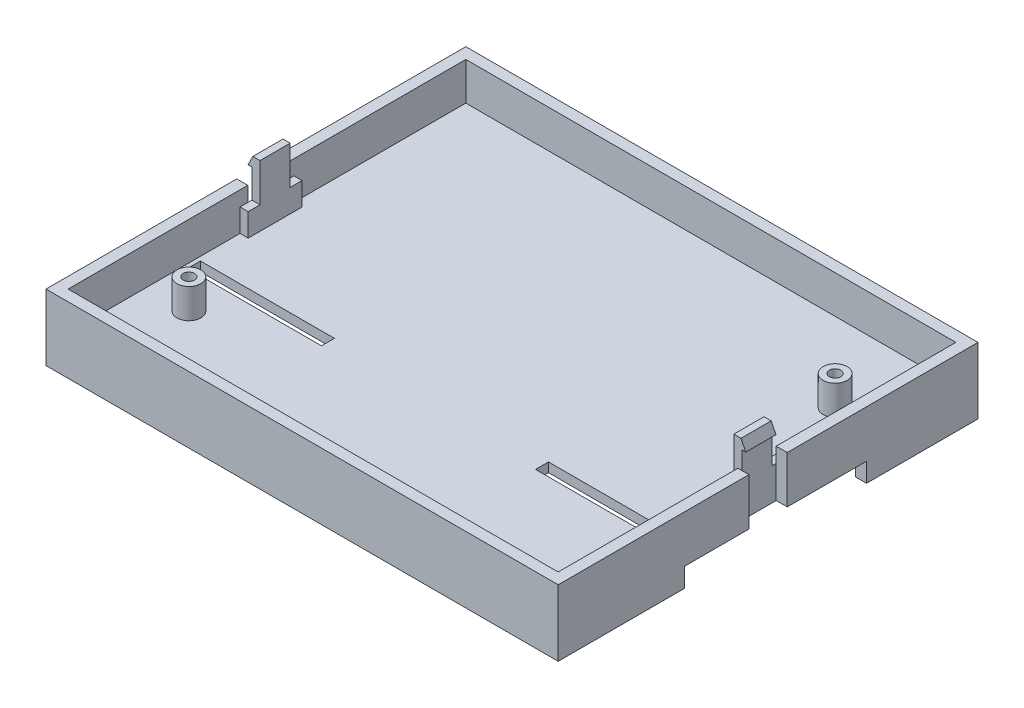
from build123d import *

# Parameters (mm, degrees)
SKETCH1_W           = 107
SKETCH1_H           = 87.7
BOSS_EXTRUDE1_DEPTH = 13.85
SKETCH2_W           = 102.38
SKETCH2_H           = 83.08
CUT_EXTRUDE1_DEPTH  = 7.9
CUT_EXTRUDE2_DEPTH  = 4
SKETCH4_R           = 2.5
SKETCH4_R_2         = 1.2
BOSS_EXTRUDE2_DEPTH = 6.2
SKETCH5_W           = 28
SKETCH5_H           = 2.7
CUT_EXTRUDE3_DEPTH  = 3.5
CHAMFER1_SIZE       = 2
SKETCH6_W           = 8
SKETCH6_H           = 9.85
CUT_EXTRUDE4_DEPTH  = 2.31
SKETCH7_W           = 11.25
SKETCH7_H           = 4.8
BOSS_EXTRUDE3_DEPTH = 1.7
BOSS_EXTRUDE4_DEPTH = 3.15


with BuildPart() as part:
    # Sketch1 → Boss-Extrude1 (new body)
    with BuildSketch(Plane(origin=(0, 0, 0), x_dir=(1, 0, 0), z_dir=(0, 1, 0))):
        Rectangle(SKETCH1_W, SKETCH1_H)
    extrude(amount=BOSS_EXTRUDE1_DEPTH)

    # Sketch2 → Cut-Extrude1 (cut)
    with BuildSketch(Plane(origin=(0, 13.85, 0), x_dir=(1, 0, 0), z_dir=(0, 1, 0))):
        Rectangle(SKETCH2_W, SKETCH2_H)
    extrude(amount=-CUT_EXTRUDE1_DEPTH, mode=Mode.SUBTRACT)

    # Sketch3 → Cut-Extrude2 (cut)
    with BuildSketch(Plane.XZ):
        Polygon((-51.19, 41.54), (51.19, 41.54), (51.19, 19.24), (23.5, 19.24), (23.5, 14.74), (49.4, 14.74), (49.4, 17.44), (53.5, 17.44), (53.5, -20.56), (51.19, -20.56), (51.19, -41.54), (10.19, -41.54), (10.19, -22.86), (40.69, -22.86), (42.704360061, -23.54), (43.44, -21.360818071), (41.067741267, -20.56), (6.19, -20.56), (6.19, -43.85), (-6.19, -43.85), (-6.19, -20.56), (-41.067741267, -20.56), (-43.44, -21.360818071), (-42.704360061, -23.54), (-40.69, -22.86), (-10.19, -22.86), (-10.19, -41.54), (-51.19, -41.54), (-51.19, -20.56), (-53.5, -20.56), (-53.5, 17.44), (-49.4, 17.44), (-49.4, 14.74), (-23.5, 14.74), (-23.5, 19.24), (-51.19, 19.24), align=None)
    extrude(amount=-CUT_EXTRUDE2_DEPTH, mode=Mode.SUBTRACT)

    # Sketch4 → Boss-Extrude2 (add)
    # profile 1 of 2: a face of its own
    with BuildSketch(Plane(origin=(0, 5.95, 0), x_dir=(1, 0, 0), z_dir=(0, 1, 0))):
        with Locations(Location((-42.5, -25, 0), (0, 0, 90))):
            Circle(SKETCH4_R)
        with Locations(Location((-42.5, -25, 0), (0, 0, 90))):
            Circle(SKETCH4_R_2, mode=Mode.SUBTRACT)
    # profile 2 of 2: a face of its own
    with BuildSketch(Plane(origin=(0, 5.95, 0), x_dir=(1, 0, 0), z_dir=(0, 1, 0))):
        with Locations(Location((42.5, 25, 0), (0, 0, 90))):
            Circle(SKETCH4_R)
        with Locations(Location((42.5, 25, 0), (0, 0, 90))):
            Circle(SKETCH4_R_2, mode=Mode.SUBTRACT)
    extrude(amount=BOSS_EXTRUDE2_DEPTH)

    # Sketch5 → Cut-Extrude3 (cut)
    with BuildSketch(Plane(origin=(0, 5.95, 0), x_dir=(1, 0, 0), z_dir=(0, 1, 0))):
        with Locations((-36.36, -16.09)):
            Rectangle(SKETCH5_W, SKETCH5_H)
        with Locations((36.36, -16.09)):
            Rectangle(SKETCH5_W, SKETCH5_H)
    extrude(amount=-CUT_EXTRUDE3_DEPTH, mode=Mode.SUBTRACT)

    # Chamfer1
    chamfer1_edges = [part.edges().sort_by_distance(p)[0] for p in [
        (-36.45, 2.45, 14.74),
        (36.45, 2.45, 14.74),
    ]]
    chamfer(chamfer1_edges, length=CHAMFER1_SIZE)

    # Sketch6 → Cut-Extrude4 (cut)
    with BuildSketch(Plane.ZY.offset(53.5)):
        with Locations((0, 8.925)):
            Rectangle(SKETCH6_W, SKETCH6_H)
    cut_extrude4 = extrude(amount=-CUT_EXTRUDE4_DEPTH, mode=Mode.SUBTRACT)

    # Sketch7 → Boss-Extrude3 (add)
    with BuildSketch(Plane(origin=(-51.19, 0, 0), x_dir=(0, 0, -1), z_dir=(1, 0, 0))):
        with Locations((0, 8.35)):
            Rectangle(SKETCH7_W, SKETCH7_H)
    boss_extrude3 = extrude(amount=BOSS_EXTRUDE3_DEPTH)

    # Sketch8 → Boss-Extrude4 (add, symmetric)
    with BuildSketch(Plane.XY):
        Polygon((-49.49, 10.75), (-49.49, 18.75), (-50.99, 18.75), (-51.99, 16.75), (-51.19, 16.75), (-51.19, 10.75), align=None)
    boss_extrude4 = extrude(amount=BOSS_EXTRUDE4_DEPTH, both=True)

    # Mirror1: Cut-Extrude4, Boss-Extrude3, Boss-Extrude4 across plane
    add(cut_extrude4.mirror(Plane(origin=(0, 0, 0), x_dir=(0, 0, 1), z_dir=(1, 0, 0))), mode=Mode.SUBTRACT)
    add(boss_extrude3.mirror(Plane(origin=(0, 0, 0), x_dir=(0, 0, 1), z_dir=(1, 0, 0))))
    add(boss_extrude4.mirror(Plane(origin=(0, 0, 0), x_dir=(0, 0, 1), z_dir=(1, 0, 0))))


solid = part.part
